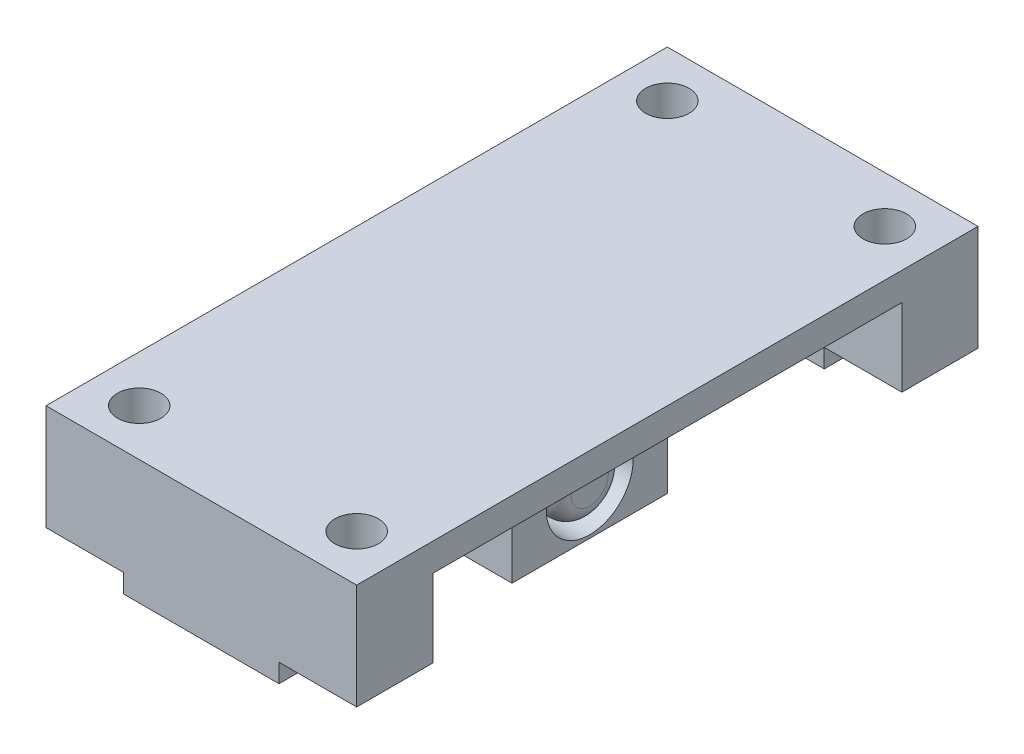
from build123d import *

# Parameters (mm, degrees)
SKETCH_1_R          = 2
EXTRUDE_1_DEPTH     = 5
SKETCH_3_W          = 40
SKETCH_3_H          = 1.796813629
EXTRUDE_2_DEPTH     = 10
SKETCH_4_R          = 1.4
CUT_EXTRUDE_2_DEPTH = 20
SKETCH_6_R          = 2.5
EXTRUDE_3_DEPTH     = 7
SKETCH_7_R          = 2.8
SKETCH_7_R_2        = 2.2
CUT_EXTRUDE_3_DEPTH = 5
FILLET_1_R          = 1
EXTRUDE_START       = 5
SKETCH_8_W          = 5
SKETCH_8_H          = 4.9
SKETCH_8_R          = 1.4
EXTRUDE_4_DEPTH     = 5


with BuildPart() as part:
    # 스케치1 → 보스-돌출1 (new, symmetric)
    with BuildSketch(Plane(origin=(0, 0, 0), x_dir=(0, 0, -1), z_dir=(1, 0, 0))):
        Polygon((20, 6.896813629), (-20, 6.896813629), (-20, -1.103186371), (-15.1, -1.103186371), (-15.1, 5.1), (-5, 5.1), (-5, -3), (5, -3), (5, 5.1), (15.1, 5.1), (15.1, -1.103186371), (20, -1.103186371), align=None)
        Circle(SKETCH_1_R, mode=Mode.SUBTRACT)
    extrude(amount=EXTRUDE_1_DEPTH, both=True)

    # 스케치3 → 보스-돌출2 (add, symmetric)
    with BuildSketch(Plane(origin=(0, 0, 0), x_dir=(0, 0, -1), z_dir=(1, 0, 0))):
        with Locations((0, 5.998406815)):
            Rectangle(SKETCH_3_W, SKETCH_3_H)
    extrude(amount=EXTRUDE_2_DEPTH, both=True)

    # 스케치4 → 컷-돌출2 (cut)
    with BuildSketch(Plane(origin=(0, 0, 0), x_dir=(1, 0, 0), z_dir=(0, 1, 0))):
        with Locations(Location((-7, -17, 0), (0, 0, 90))):
            Circle(SKETCH_4_R)
        with Locations(Location((7, -17, 0), (0, 0, 90))):
            Circle(SKETCH_4_R)
        with Locations(Location((7, 17, 0), (0, 0, 90))):
            Circle(SKETCH_4_R)
        with Locations(Location((-7, 17, 0), (0, 0, 90))):
            Circle(SKETCH_4_R)
    extrude(amount=CUT_EXTRUDE_2_DEPTH, mode=Mode.SUBTRACT)

    # 스케치6 → 보스-돌출3 (add)
    with BuildSketch(Plane(origin=(5, 0, 0), x_dir=(0, 0, -1), z_dir=(1, 0, 0))):
        Circle(SKETCH_6_R)
    extrude(amount=-EXTRUDE_3_DEPTH)

    # 스케치7 → 컷-돌출3 (cut)
    with BuildSketch(Plane(origin=(5, 0, 0), x_dir=(0, 0, -1), z_dir=(1, 0, 0))):
        Circle(SKETCH_7_R)
        Circle(SKETCH_7_R_2, mode=Mode.SUBTRACT)
    extrude(amount=-CUT_EXTRUDE_3_DEPTH, mode=Mode.SUBTRACT)

    # 필렛1
    fillet_1_edges = [part.edges().sort_by_distance(p)[0] for p in [
        (5, 0, 2.2),
    ]]
    fillet(fillet_1_edges, radius=FILLET_1_R)

    # 스케치8 → 보스-돌출4 (add)
    # profile 1 of 4: a face of its own
    with BuildSketch(Plane.XZ.offset(-5.1).offset(EXTRUDE_START)):
        with Locations((-7.5, 17.55)):
            Rectangle(SKETCH_8_W, SKETCH_8_H)
        with Locations(Location((-7, 17, 0), (0, 0, 270))):
            Circle(SKETCH_8_R, mode=Mode.SUBTRACT)
    # profile 2 of 4: a face of its own
    with BuildSketch(Plane.XZ.offset(-5.1).offset(EXTRUDE_START)):
        with Locations((7.5, 17.55)):
            Rectangle(SKETCH_8_W, SKETCH_8_H)
        with Locations(Location((7, 17, 0), (0, 0, 270))):
            Circle(SKETCH_8_R, mode=Mode.SUBTRACT)
    # profile 3 of 4: a face of its own
    with BuildSketch(Plane.XZ.offset(-5.1).offset(EXTRUDE_START)):
        with Locations((-7.5, -17.55)):
            Rectangle(SKETCH_8_W, SKETCH_8_H)
        with Locations(Location((-7, -17, 0), (0, 0, 270))):
            Circle(SKETCH_8_R, mode=Mode.SUBTRACT)
    # profile 4 of 4: a face of its own
    with BuildSketch(Plane.XZ.offset(-5.1).offset(EXTRUDE_START)):
        with Locations((7.5, -17.55)):
            Rectangle(SKETCH_8_W, SKETCH_8_H)
        with Locations(Location((7, -17, 0), (0, 0, 270))):
            Circle(SKETCH_8_R, mode=Mode.SUBTRACT)
    extrude(amount=-EXTRUDE_4_DEPTH)


solid = part.part
